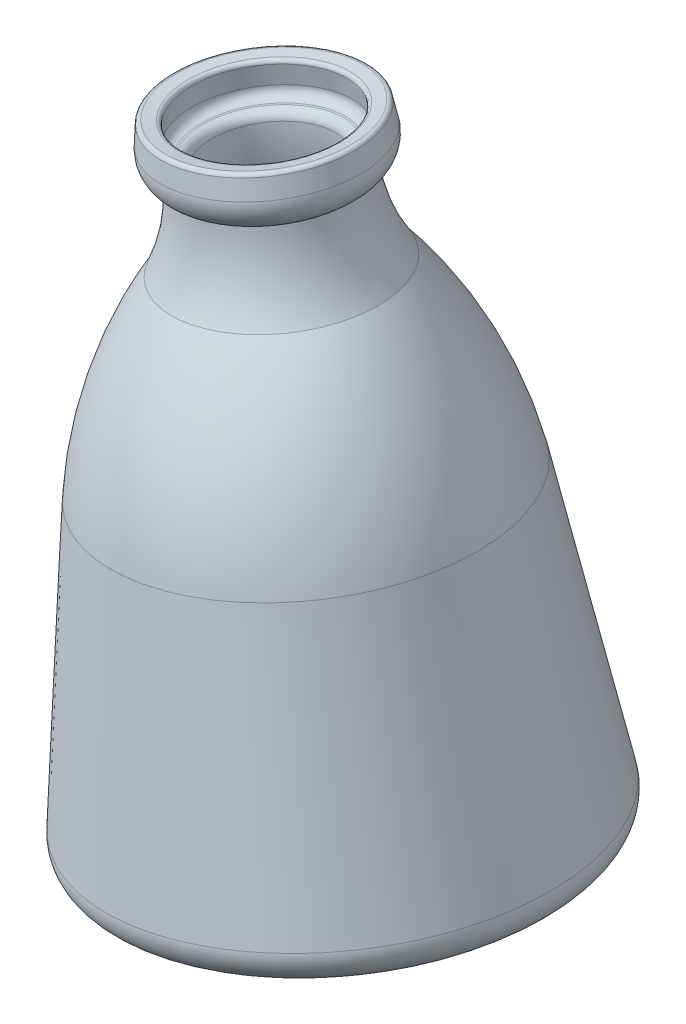
from build123d import *

# Parameters (mm, degrees)
CUT_EXTRUDE1_REACH = 391.498


with BuildPart() as part:
    # Sketch2 → Revolve1 (revolve)
    with BuildSketch(Plane.XY, mode=Mode.PRIVATE) as revolve1_sk:
        with BuildLine():
            Line((-0.032133134, 10.000103255), (-0.032133134, 0.000103255))
            ThreePointArc((-0.032133134, 0.000103255), (1.43233296, -3.535430651), (4.967866866, -4.999896745))
            Line((4.967866866, -4.999896745), (6.002570929, -4.999896745))
            ThreePointArc((6.002570929, -4.999896745), (9.249544657, -6.197639309), (10.94090293, -9.217032101))
            ThreePointArc((10.94090293, -9.217032101), (11.571044404, -35.841541115), (5.151354262, -61.688187649))
            ThreePointArc((5.151354262, -61.688187649), (-14.070276669, -107.843610688), (-21.243391364, -157.324320031))
            Line((-21.243391364, -157.324320031), (-21.243391364, -302.324320031))
            ThreePointArc((-21.243391364, -302.324320031), (-19.77892527, -305.859853937), (-16.243391364, -307.324320031))
            Line((-16.243391364, -307.324320031), (33.756608636, -307.324320031))
            ThreePointArc((33.756608636, -307.324320031), (57.760906859, -299.124999465), (82.609967669, -294.029965821))
            Line((82.609967669, -294.029965821), (83.993303824, -303.9338227))
            ThreePointArc((83.993303824, -303.9338227), (59.43974015, -309.034428074), (35.771800747, -317.324320031))
            Line((35.771800747, -317.324320031), (-16.243391364, -317.324320031))
            ThreePointArc((-16.243391364, -317.324320031), (-26.849993082, -312.930921749), (-31.243391364, -302.324320031))
            Line((-31.243391364, -302.324320031), (-31.243391364, -157.232242651))
            ThreePointArc((-31.243391364, -157.232242651), (-23.820930581, -105.587090964), (-3.895404303, -57.365850629))
            ThreePointArc((-3.895404303, -57.365850629), (1.443112257, -36.32301649), (1.587497368, -14.614037228))
            ThreePointArc((1.587497368, -14.614037228), (-6.773205114, -9.335164752), (-10.032133134, 0.000103255))
            Line((-10.032133134, 0.000103255), (-10.032133134, 10.000103255))
            ThreePointArc((-10.032133134, 10.000103255), (-9.446346697, 11.414316817), (-8.032133134, 12.000103255))
            Line((-8.032133134, 12.000103255), (-2.032133134, 12.000103255))
            ThreePointArc((-2.032133134, 12.000103255), (-0.617919572, 11.414316817), (-0.032133134, 10.000103255))
        make_face()
    revolve(revolve1_sk.sketch.rotate(Axis((83.993303824, -303.9338227, 0), (-0.1383336154754439, 0.9903856879163249, 0)), 180), axis=Axis((83.993303824, -303.9338227, 0), (-0.1383336154754439, 0.9903856879163249, 0)))

    # Cut-Extrude1: up to this cone (the profile starts inside it)
    cut_extrude1_end = Plane(origin=(78.595138582, -265.286198417, 0), z_dir=(0.1383336154754439, -0.9903856879163249, 0)) * Cone(40.661095389, 181.148511286, 1005.805606674, mode=Mode.PRIVATE)
    # Sketch3 → Cut-Extrude1 (cut, up to the surface)
    with BuildSketch(Plane(origin=(0, 0, 0), x_dir=(0, 0, -1), z_dir=(1, 0, 0)), mode=Mode.PRIVATE) as cut_extrude1_sk1:
        Polygon((2.87888768, -299.358103554), (22.878887708, -287.811098154), (22.878887708, -264.717087354), (2.87888768, -253.170081954), (-17.121112348, -264.717087354), (-17.121112348, -287.811098154), align=None)
    cut_extrude1_tool1 = extrude(cut_extrude1_sk1.sketch, amount=-CUT_EXTRUDE1_REACH, mode=Mode.PRIVATE) & cut_extrude1_end
    add(cut_extrude1_tool1.solids().sort_by_distance((0, -276.264093, -2.878888))[0], mode=Mode.SUBTRACT)


solid = part.part
